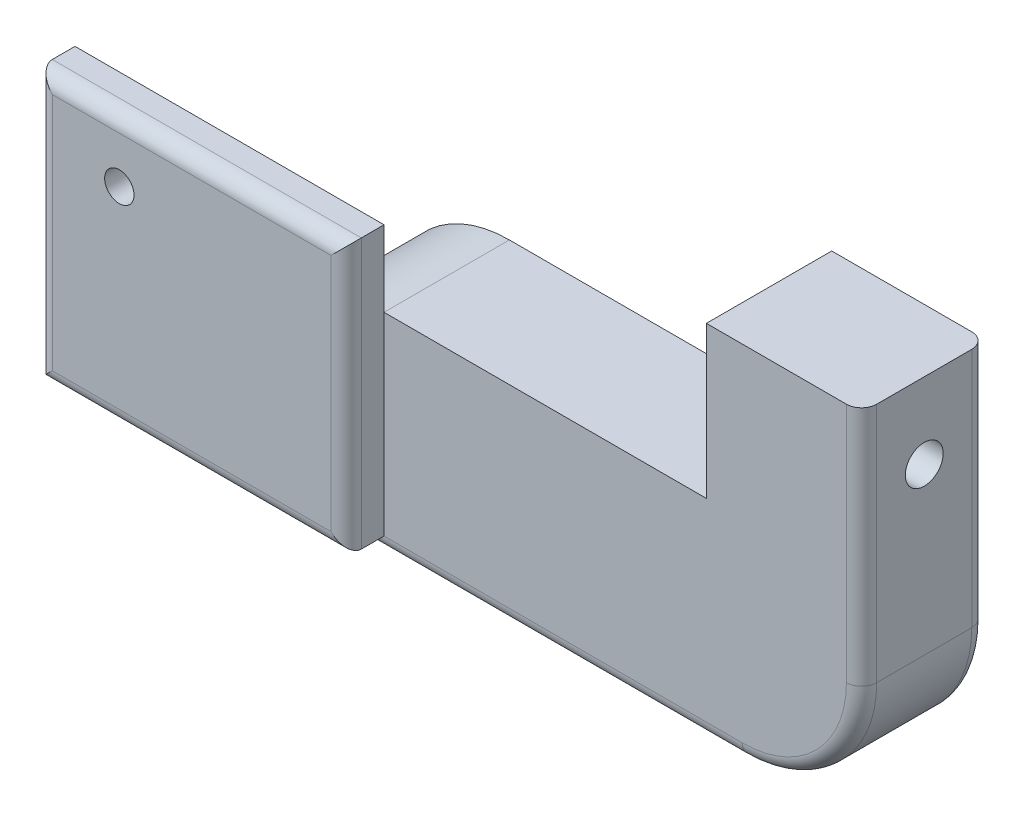
from build123d import *

# Parameters (mm, degrees)
BOSS_EXTRUDE1_DEPTH         = 21
FILLET2_R                   = 2.54
SKETCH2_W                   = 51.77099925
SKETCH2_H                   = 45.16
BOSS_EXTRUDE2_DEPTH         = 6.35
F_8_CLEARANCE_HOLE1_D       = 4.9149
FILLET3_R                   = 2.54
F_1_4_0_25_DIAMETER_HOLE1_D = 6.35
CUT_EXTRUDE1_DEPTH          = 16.475


with BuildPart() as part:
    # Sketch1 → Boss-Extrude1 (new body)
    with BuildSketch(Plane.XY):
        with BuildLine():
            Line((-50, -17.5), (30, -17.5))
            ThreePointArc((30, -17.5), (44.142135624, -11.642135624), (50, 2.5))
            Line((50, 2.5), (50, 17.5))
            Line((50, 17.5), (50, 42.9))
            Line((50, 42.9), (24, 42.9))
            Line((24, 42.9), (24, 17.5))
            Line((24, 17.5), (-30, 17.5))
            ThreePointArc((-30, 17.5), (-44.142135624, 11.642135624), (-50, -2.5))
            Line((-50, -2.5), (-50, -17.5))
        make_face()
    extrude(amount=BOSS_EXTRUDE1_DEPTH)

    # Fillet2
    fillet2_edges = [part.edges().sort_by_distance(p)[0] for p in [
        (-10, -17.5, 0),
        (-10, -17.5, 21),
        (44.142135624, -11.642135624, 21),
        (50, 22.7, 21),
        (50, 22.7, 0),
        (44.142135624, -11.642135624, 0),
    ]]
    fillet(fillet2_edges, radius=FILLET2_R)

    # Sketch2 → Boss-Extrude2 (add)
    with BuildSketch(Plane.XY.offset(21)):
        with Locations((-55.885499625, 7.62)):
            Rectangle(SKETCH2_W, SKETCH2_H)
    extrude(amount=BOSS_EXTRUDE2_DEPTH)

    # #8 Clearance Hole1 (through all)
    with Locations(Plane.XY.offset(27.35)):
        with Locations((-68, 19.9)):
            Hole(F_8_CLEARANCE_HOLE1_D / 2)

    # Fillet3
    fillet3_edges = [part.edges().sort_by_distance(p)[0] for p in [
        (-30, 7.62, 27.35),
        (-55.885499625, 30.2, 27.35),
        (-81.77099925, 7.62, 27.35),
        (-55.885499625, -14.96, 27.35),
    ]]
    fillet(fillet3_edges, radius=FILLET3_R)

    # 1/4 (0.25) Diameter Hole1 (through all)
    with Locations(Plane.ZY.offset(-24)):
        with Locations((10.5, 30.2)):
            Hole(F_1_4_0_25_DIAMETER_HOLE1_D / 2)

    # Sketch8 → Cut-Extrude1 (cut)
    with BuildSketch(Plane.ZY.offset(-24)):
        Polygon((13.781225917, 35.88325), (7.218774083, 35.88325), (3.937548165, 30.2), (7.218774083, 24.51675), (13.781225917, 24.51675), (17.062451835, 30.2), align=None)
    extrude(amount=-CUT_EXTRUDE1_DEPTH, mode=Mode.SUBTRACT)


solid = part.part
